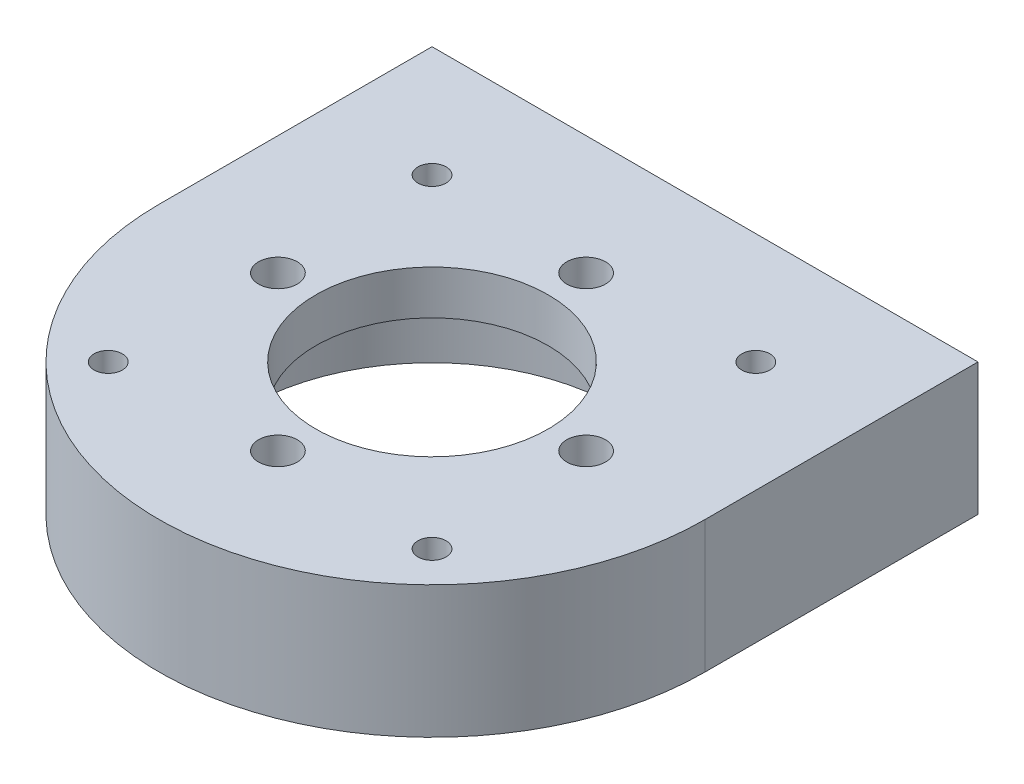
from build123d import *

# Parameters (mm, degrees)
SKETCH_1_R      = 31
SKETCH_1_R_2    = 1.6
SKETCH_1_R_3    = 21.1
EXTRUDE_1_DEPTH = 15
EXTRUDE_START   = -10
SKETCH_2_R      = 21.1
SKETCH_2_R_2    = 13.2
SKETCH_2_R_3    = 2.2
EXTRUDE_2_DEPTH = 5


with BuildPart() as part:
    # 草图1 → 凸台-拉伸1 (new body)
    # profile 1 of 3: a face of its own
    with BuildSketch(Plane(origin=(0, 0, 0), x_dir=(1, 0, 0), z_dir=(0, 1, 0))):
        Circle(SKETCH_1_R)
        with Locations(Location((-18.384776311, 18.384776311, 0), (0, 0, 270))):
            Circle(SKETCH_1_R_2, mode=Mode.SUBTRACT)
        with Locations(Location((-18.384776311, -18.384776311, 0), (0, 0, 270))):
            Circle(SKETCH_1_R_2, mode=Mode.SUBTRACT)
        with Locations(Location((18.384776311, -18.384776311, 0), (0, 0, 270))):
            Circle(SKETCH_1_R_2, mode=Mode.SUBTRACT)
        with Locations(Location((18.384776311, 18.384776311, 0), (0, 0, 270))):
            Circle(SKETCH_1_R_2, mode=Mode.SUBTRACT)
        with Locations(Location((0, 0, 0), (0, 0, 270))):
            Circle(SKETCH_1_R_3, mode=Mode.SUBTRACT)
    # profile 2 of 3: a face of its own
    with BuildSketch(Plane(origin=(0, 0, 0), x_dir=(1, 0, 0), z_dir=(0, 1, 0))):
        with BuildLine():
            Line((-31, 31), (-31, 0))
            ThreePointArc((-31, 0), (-21.920310218, 21.920310215), (-4e-09, 31))
            Line((-4e-09, 31), (-31, 31))
        make_face()
    # profile 3 of 3: a face of its own
    with BuildSketch(Plane(origin=(0, 0, 0), x_dir=(1, 0, 0), z_dir=(0, 1, 0))):
        with BuildLine():
            ThreePointArc((-4e-09, 31), (21.920310215, 21.920310218), (31, 0))
            Line((31, 0), (31, 31))
            Line((31, 31), (-4e-09, 31))
        make_face()
    extrude(amount=EXTRUDE_1_DEPTH)

    # 草图2 → 凸台-拉伸2 (add)
    with BuildSketch(Plane.XZ.offset(EXTRUDE_START)):
        with Locations(Location((0, 0, 0), (0, 0, 270))):
            Circle(SKETCH_2_R)
        with Locations(Location((0, 0, 0), (0, 0, 270))):
            Circle(SKETCH_2_R_2, mode=Mode.SUBTRACT)
        with Locations(Location((0, 17.5, 0), (0, 0, 270))):
            Circle(SKETCH_2_R_3, mode=Mode.SUBTRACT)
        with Locations(Location((17.5, 0, 0), (0, 0, 270))):
            Circle(SKETCH_2_R_3, mode=Mode.SUBTRACT)
        with Locations(Location((0, -17.5, 0), (0, 0, 270))):
            Circle(SKETCH_2_R_3, mode=Mode.SUBTRACT)
        with Locations(Location((-17.5, 0, 0), (0, 0, 270))):
            Circle(SKETCH_2_R_3, mode=Mode.SUBTRACT)
    extrude(amount=-EXTRUDE_2_DEPTH)


solid = part.part
